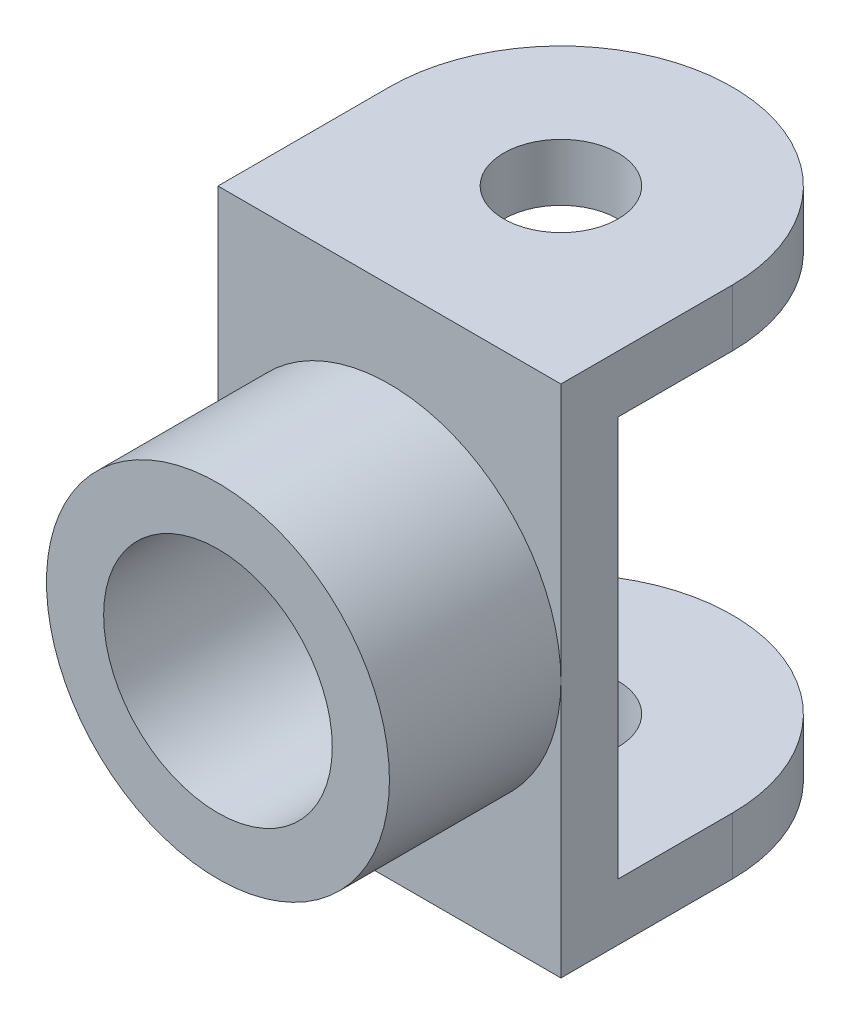
from build123d import *

# Parameters (mm, degrees)
BOSS_EXTRUDE4_DEPTH     = 90
CUT_EXTRUDE1_DEPTH      = 69
CUT_EXTRUDE1_DEPTH_BACK = 18
SKETCH7_W               = 55.395667886
SKETCH7_H               = 70
SKETCH8_R               = 30
SKETCH8_R_2             = 20
BOSS_EXTRUDE5_DEPTH     = 30


with BuildPart() as part:
    # Sketch5 → Boss-Extrude4 (new body)
    with BuildSketch(Plane(origin=(0, 0, 0), x_dir=(1, 0, 0), z_dir=(0, 1, 0))):
        with BuildLine():
            Line((0, 30), (0, 0))
            Line((0, 0), (60, 0))
            Line((60, 0), (60, 30))
            Line((60, 30), (40, 30))
            ThreePointArc((40, 30), (30, 20), (20, 30))
            Line((20, 30), (0, 30))
        make_face()
        with BuildLine():
            ThreePointArc((60, 30), (30, 60), (0, 30))
            Line((0, 30), (20, 30))
            ThreePointArc((20, 30), (30, 40), (40, 30))
            Line((40, 30), (60, 30))
        make_face()
    extrude(amount=BOSS_EXTRUDE4_DEPTH)

    # Sketch7 → Cut-Extrude1 (cut, two sides: drawn at the far end of the back side and taken through both)
    with BuildSketch(Plane(origin=(0, 0, 0), x_dir=(0, 0, -1), z_dir=(1, 0, 0)).offset(-CUT_EXTRUDE1_DEPTH_BACK)):
        with Locations((37.697833943, 45)):
            Rectangle(SKETCH7_W, SKETCH7_H)
    extrude(amount=CUT_EXTRUDE1_DEPTH + CUT_EXTRUDE1_DEPTH_BACK, mode=Mode.SUBTRACT)

    # Sketch8 → Boss-Extrude5 (add)
    with BuildSketch(Plane.XY):
        with Locations((30, 45)):
            Circle(SKETCH8_R)
        with Locations((30, 45)):
            Circle(SKETCH8_R_2, mode=Mode.SUBTRACT)
    extrude(amount=BOSS_EXTRUDE5_DEPTH)


solid = part.part
